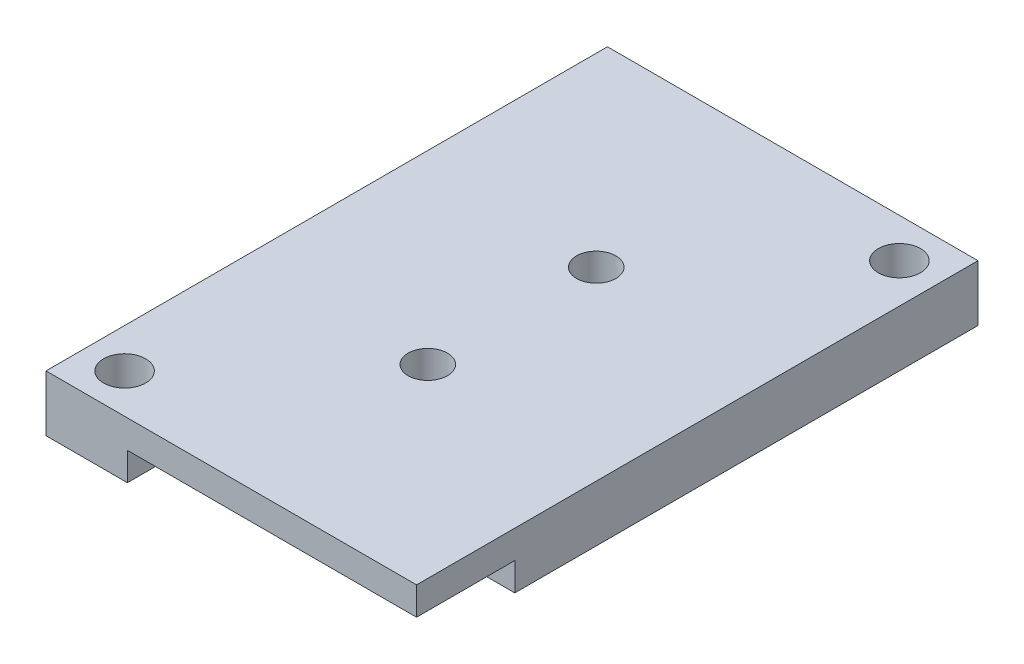
from build123d import *

# Parameters (mm, degrees)
SKETCH_1_W          = 13.2
SKETCH_1_H          = 20
EXTRUDE_1_DEPTH     = 2
SKETCH_1_3_R        = 0.75
CUT_EXTRUDE_2_DEPTH = 13.147427711
CUT_EXTRUDE_START   = -2
CUT_EXTRUDE_1_DEPTH = 1
SKETCH_2_4_R        = 0.7
CUT_EXTRUDE_3_DEPTH = 13.147427711


with BuildPart() as part:
    # 草图1 → 凸台-拉伸1 (new body)
    with BuildSketch(Plane(origin=(0, 0, 0), x_dir=(1, 0, 0), z_dir=(0, 1, 0))):
        Rectangle(SKETCH_1_W, SKETCH_1_H)
    extrude(amount=EXTRUDE_1_DEPTH)

    # 草图1<3> → 切除-拉伸2 (cut, through all)
    with BuildSketch(Plane(origin=(0, 0, 0), x_dir=(1, 0, 0), z_dir=(0, 1, 0))):
        with Locations(Location((-5.2, -8.6, 0), (0, 0, 270))):
            Circle(SKETCH_1_3_R)
        with Locations(Location((5.2, 8.6, 0), (0, 0, 270))):
            Circle(SKETCH_1_3_R)
    extrude(amount=CUT_EXTRUDE_2_DEPTH, mode=Mode.SUBTRACT)

    # 草图2 → 切除-拉伸1 (cut)
    with BuildSketch(Plane(origin=(0, 2, 0), x_dir=(1, 0, 0), z_dir=(0, 1, 0)).offset(CUT_EXTRUDE_START)):
        Polygon((3.7, 10), (-6.6, 10), (-6.6, 6.5), (-2.5, 6.5), (-2.5, -6.5), (-3.7, -6.5), (-3.7, -10), (6.6, -10), (6.6, -6.5), (2.5, -6.5), (2.5, 6.5), (3.7, 6.5), align=None)
    extrude(amount=CUT_EXTRUDE_1_DEPTH, mode=Mode.SUBTRACT)

    # 草图2<4> → 切除-拉伸3 (cut, through all)
    with BuildSketch(Plane(origin=(0, 2, 0), x_dir=(1, 0, 0), z_dir=(0, 1, 0))):
        with Locations(Location((0, 3, 0), (0, 0, 270))):
            Circle(SKETCH_2_4_R)
        with Locations(Location((0, -3, 0), (0, 0, 270))):
            Circle(SKETCH_2_4_R)
    extrude(amount=-CUT_EXTRUDE_3_DEPTH, mode=Mode.SUBTRACT)


solid = part.part
